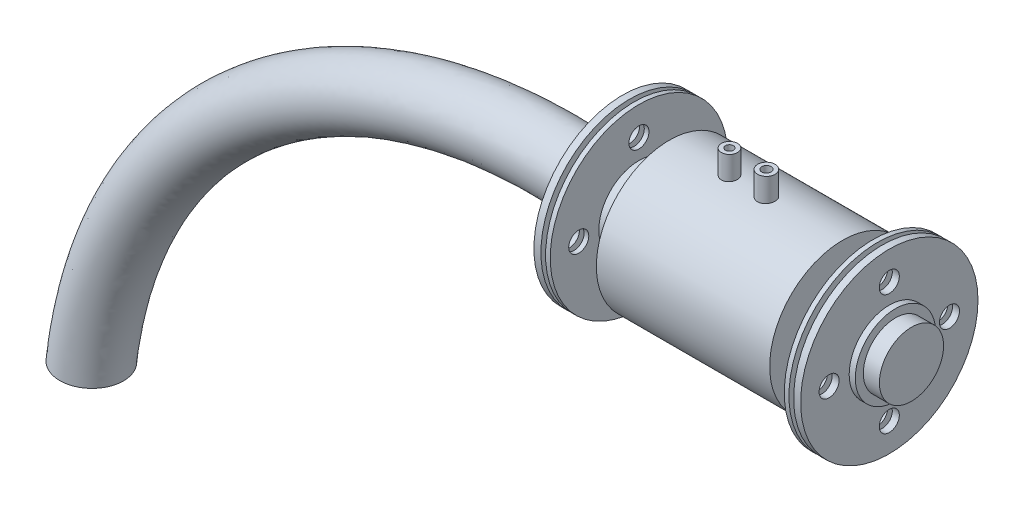
from build123d import *

# Parameters (mm, degrees)
SKETCH2_R                = 3.996978994
SKETCH2_R_2              = 4.344542385
BOSS_EXTRUDE1_DEPTH      = 48
SKETCH3_R                = 2.344542385
SKETCH3_R_2              = 1.996978994
CUT_EXTRUDE1_DEPTH       = 48
SKETCH4_R                = 5
CUT_EXTRUDE2_DEPTH       = 19
CUT_EXTRUDE3_START       = 129
SKETCH4_2_R              = 5
CUT_EXTRUDE3_DEPTH       = 19
BOSS_EXTRUDE2_DEPTH      = 4
BOSS_EXTRUDE2_DEPTH_BACK = 136
SKETCH5_R                = 20
SKETCH6_R                = 16


with BuildPart() as part:
    # Sketch1 → Revolve2 (revolve)
    with BuildSketch(Plane.XY):
        Polygon((133.818181818, 0), (133.818181818, 16), (122.763636364, 16), (122.763636364, 44.218181818), (119.272727273, 44.218181818), (119.272727273, 0.301244101), (116.945454545, 0.301244101), (116.945454545, 44.218181818), (114.618181818, 44.218181818), (114.618181818, 16), (99.490909091, 16), (99.490909091, 36.363636364), (13.090909091, 36.363636364), (13.090909091, 16), (-2.036363636, 16), (-2.036363636, 44.218181818), (-4.363636364, 44.218181818), (-4.363636364, 0.301244101), (-6.690909091, 0.301244101), (-6.690909091, 44.218181818), (-10.181818182, 44.218181818), (-10.181818182, 16), (-21.236363636, 16), (-21.236363636, 0), align=None)
    revolve(axis=Axis((0, 0, 0), (-1, 0, 0)))

    # Sketch2 → Boss-Extrude1 (add)
    with BuildSketch(Plane(origin=(0, 0, 0), x_dir=(1, 0, 0), z_dir=(0, 1, 0))):
        with Locations((43.08350024, 0)):
            Circle(SKETCH2_R)
        with Locations((61.504359953, 0)):
            Circle(SKETCH2_R_2)
    extrude(amount=BOSS_EXTRUDE1_DEPTH)

    # Sketch3 → Cut-Extrude1 (cut)
    with BuildSketch(Plane(origin=(0, 48, 0), x_dir=(1, 0, 0), z_dir=(0, 1, 0))):
        with Locations((61.504359953, 0)):
            Circle(SKETCH3_R)
        with Locations((43.08350024, 0)):
            Circle(SKETCH3_R_2)
    extrude(amount=-CUT_EXTRUDE1_DEPTH, mode=Mode.SUBTRACT)

    # Sketch4 → Cut-Extrude2 (cut)
    with BuildSketch(Plane(origin=(0, 0, 0), x_dir=(0, 0, -1), z_dir=(1, 0, 0))):
        with Locations((0, 30)):
            Circle(SKETCH4_R)
        with Locations((30, 0)):
            Circle(SKETCH4_R)
        with Locations((0, -30)):
            Circle(SKETCH4_R)
        with Locations((-30, 0)):
            Circle(SKETCH4_R)
    extrude(amount=-CUT_EXTRUDE2_DEPTH, mode=Mode.SUBTRACT)

    # Sketch4<2> → Cut-Extrude3 (cut)
    with BuildSketch(Plane(origin=(0, 0, 0), x_dir=(0, 0, -1), z_dir=(1, 0, 0)).offset(CUT_EXTRUDE3_START)):
        with Locations((0, 30)):
            Circle(SKETCH4_2_R)
        with Locations((30, 0)):
            Circle(SKETCH4_2_R)
        with Locations((0, -30)):
            Circle(SKETCH4_2_R)
        with Locations((-30, 0)):
            Circle(SKETCH4_2_R)
    extrude(amount=-CUT_EXTRUDE3_DEPTH, mode=Mode.SUBTRACT)

    # Sketch5 → Boss-Extrude2 (add, two sides: drawn at the far end of the back side and taken through both)
    with BuildSketch(Plane.ZY.offset(10.181818182).offset(-BOSS_EXTRUDE2_DEPTH_BACK)):
        Circle(SKETCH5_R)
    extrude(amount=BOSS_EXTRUDE2_DEPTH + BOSS_EXTRUDE2_DEPTH_BACK)

    # Sweep1: sweep along a path in Sketch7
    with BuildLine(Plane.XY) as sweep1_path:
        ThreePointArc((-21.236363636, 0), (-189.709160682, -49.779010206), (-274.996805421, -203.359773509))
    # Sketch6 → Sweep1 (sweep)
    with BuildSketch(Plane.ZY.offset(21.236363636)):
        Circle(SKETCH6_R)
    sweep(path=sweep1_path.line)


solid = part.part
